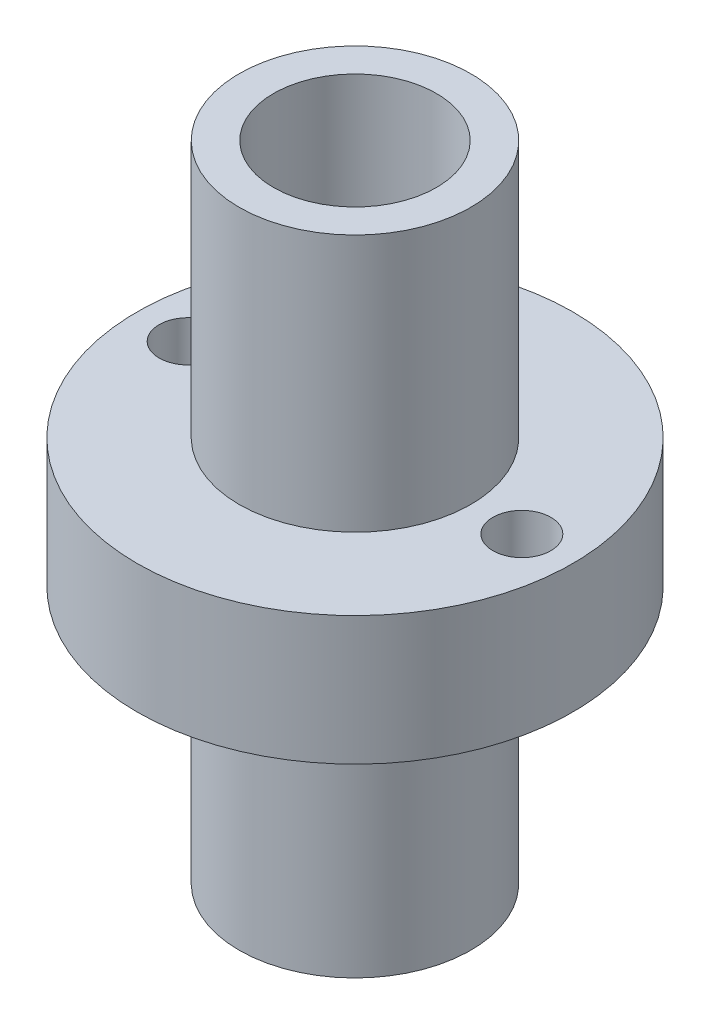
from build123d import *

# Parameters (mm, degrees)
TALADRO_DE_MARGEN_PARA_1_41_D = 6.7564


with BuildPart() as part:
    # Croquis2 → Revolución1 (revolve)
    with BuildSketch(Plane.XY, mode=Mode.PRIVATE) as revoluci_n1_sk:
        Polygon((9.5, 37.5), (9.5, -37.5), (13.5, -37.5), (13.5, -7.5), (25.4, -7.5), (25.4, 7.5), (13.5, 7.5), (13.5, 37.5), align=None)
    revolve(revoluci_n1_sk.sketch.rotate(Axis((0, 0, 0), (0, -1, 0)), 90), axis=Axis((0, 0, 0), (0, -1, 0)))

    # Taladro de margen para 1/41 (through all)
    with Locations(Plane(origin=(0, 7.5, 0), x_dir=(1, 0, 0), z_dir=(0, 1, 0))):
        with Locations((19.45, 0), (-19.45, 0)):
            Hole(TALADRO_DE_MARGEN_PARA_1_41_D / 2)


solid = part.part
